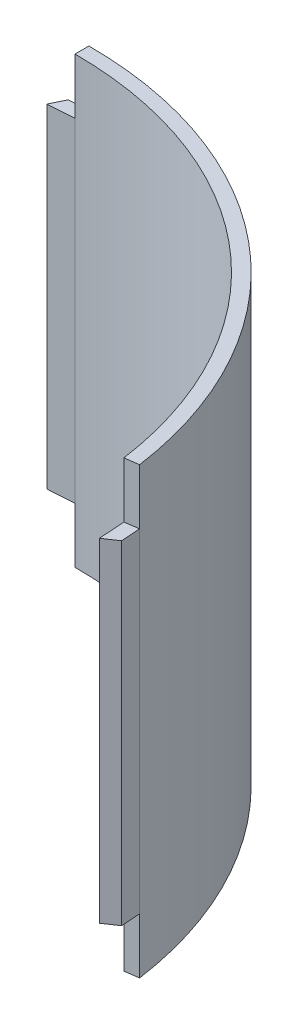
from build123d import *

# Parameters (mm, degrees)
EXTRUDE_1_DEPTH       = 800
EXTRUDE_2_DEPTH       = 300
MIRROR_3_COPY_1_DEPTH = 300
MIRROR_3_COPY_2_DEPTH = 300


with BuildPart() as part:
    # 草图1 → 凸台-拉伸1 (new body)
    with BuildSketch(Plane(origin=(0, 0, 0), x_dir=(1, 0, 0), z_dir=(0, 1, 0))):
        with BuildLine():
            Line((0, 705), (0, 680))
            ThreePointArc((0, 680), (446.120139714, 513.202514551), (673.382286744, 94.637708653))
            Line((673.382286744, 94.637708653), (698.138988463, 98.117036177))
            ThreePointArc((698.138988463, 98.117036177), (462.521615438, 532.070254057), (0, 705))
        make_face()
    extrude(amount=EXTRUDE_1_DEPTH)

    # 草图2 → 凸台-拉伸2 (add)
    with BuildSketch(Plane(origin=(0, 400, 0), x_dir=(1, 0, 0), z_dir=(0, 1, 0))):
        Polygon((698.138988463, 98.117036177), (673.382286744, 94.637708653), (676.691143372, 47.318854326), (700.56509889, 63.422040654), align=None)
    extrude_2 = extrude(amount=-EXTRUDE_2_DEPTH)

    # 镜向1: 凸台-拉伸2 across plane
    add(extrude_2.mirror(Plane(origin=(446.120139714, 800, -513.202514551), x_dir=(-0.6560590289905062, 0, 0.754709580222773), z_dir=(-0.7547095802227732, 0, -0.656059028990506))))

    # 镜向2: 凸台-拉伸2 across plane
    add(extrude_2.mirror(Plane.ZX.offset(400)))

    # 镜向3 copy 1 sketch → 镜向3 copy 1 (add)
    with BuildSketch(Plane(origin=(0, 400, 0), x_dir=(-0.13917310096006918, 0, -0.99026806874157), z_dir=(0, -1, 0))):
        Polygon((698.138988463, 98.117036177), (673.382286744, 94.637708653), (676.691143372, 47.318854326), (700.56509889, 63.422040654), align=None)
    extrude(amount=-MIRROR_3_COPY_1_DEPTH)

    # 镜向3 copy 2 sketch → 镜向3 copy 2 (add)
    with BuildSketch(Plane(origin=(0, 400, 0), x_dir=(-0.13917310096006918, 0, -0.99026806874157), z_dir=(0, 1, 0))):
        Polygon((698.138988463, -98.117036177), (673.382286744, -94.637708653), (676.691143372, -47.318854326), (700.56509889, -63.422040654), align=None)
    extrude(amount=-MIRROR_3_COPY_2_DEPTH)


solid = part.part
